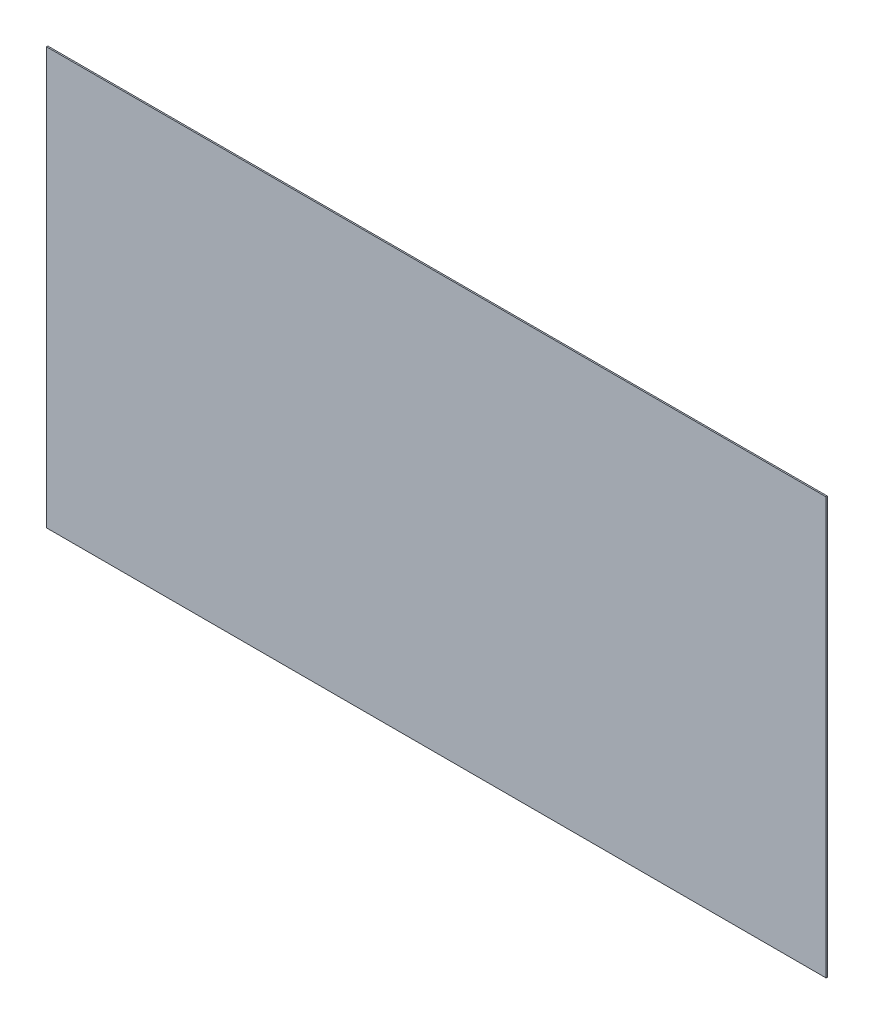
from build123d import *

# Parameters (mm, degrees)
SKETCH1_W           = 580
SKETCH1_H           = 310
BOSS_EXTRUDE1_DEPTH = 1


with BuildPart() as part:
    # Sketch1 → Boss-Extrude1 (new body)
    with BuildSketch(Plane.XY.offset(325.410196625)):
        with Locations((0, -345)):
            Rectangle(SKETCH1_W, SKETCH1_H)
    extrude(amount=BOSS_EXTRUDE1_DEPTH)


solid = part.part
